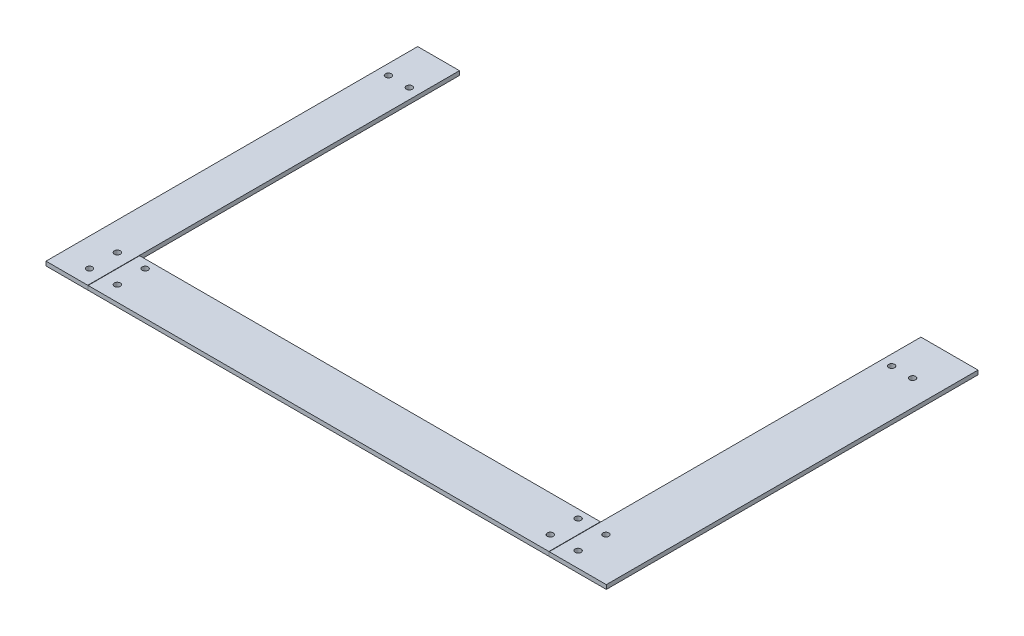
from build123d import *

# Parameters (mm, degrees)
SKETCH1_W                     = 41
SKETCH1_H                     = 267
BOSS_EXTRUDE1_DEPTH           = 3
SKETCH2_W                     = 30
SKETCH2_H                     = 267
BOSS_EXTRUDE2_DEPTH           = 3
SKETCH3_W                     = 331
SKETCH3_H                     = 37
BOSS_EXTRUDE3_DEPTH           = 3
SKETCH6_W                     = 2.15
SKETCH6_H                     = 3
M4_CLEARANCE_HOLE1_AT_2_COUNT = 2
M4_CLEARANCE_HOLE1_AT_2_PITCH = 28.284271247
M4_CLEARANCE_HOLE1_AT_3_COUNT = 2
M4_CLEARANCE_HOLE1_AT_3_PITCH = 20
M4_CLEARANCE_HOLE1_AT_4_COUNT = 2
M4_CLEARANCE_HOLE1_AT_4_PITCH = 20
M4_CLEARANCE_HOLE1_AT_5_COUNT = 2
M4_CLEARANCE_HOLE1_AT_5_PITCH = 210.068589989
M4_CLEARANCE_HOLE1_AT_6_COUNT = 2
M4_CLEARANCE_HOLE1_AT_6_PITCH = 208.257802975
MIRROR1_COPY_1_SKETCH_W       = 2.15
MIRROR1_COPY_1_SKETCH_H       = 3
MIRROR1_COPY_2_SKETCH_W       = 2.15
MIRROR1_COPY_2_SKETCH_H       = 3
MIRROR1_COPY_3_SKETCH_W       = 2.15
MIRROR1_COPY_3_SKETCH_H       = 3
MIRROR1_COPY_4_SKETCH_W       = 2.15
MIRROR1_COPY_4_SKETCH_H       = 3
MIRROR1_COPY_5_SKETCH_W       = 2.15
MIRROR1_COPY_5_SKETCH_H       = 3


with BuildPart() as part:
    # Sketch1 → Boss-Extrude1 (new body)
    with BuildSketch(Plane(origin=(0, 0, 0), x_dir=(1, 0, 0), z_dir=(0, 1, 0))):
        with Locations((186.25, -2)):
            Rectangle(SKETCH1_W, SKETCH1_H)
    extrude(amount=BOSS_EXTRUDE1_DEPTH)

    # Mirror1 copy 1 sketch → Mirror1 copy 1 (revolve, cut)
    with BuildSketch(Plane(origin=(175.5, 3, 124.5), x_dir=(0, 0, 1), z_dir=(-1, 0, 0))):
        with Locations((1.075, -1.5)):
            Rectangle(MIRROR1_COPY_1_SKETCH_W, MIRROR1_COPY_1_SKETCH_H)
    revolve(axis=Axis((175.5, 9.35, 124.5), (0, 1, 0)), mode=Mode.SUBTRACT)

    # Mirror1 copy 2 sketch → Mirror1 copy 2 (revolve, cut)
    with BuildSketch(Plane(origin=(175.5, 3, 104.5), x_dir=(0, 0, 1), z_dir=(-1, 0, 0))):
        with Locations((1.075, -1.5)):
            Rectangle(MIRROR1_COPY_2_SKETCH_W, MIRROR1_COPY_2_SKETCH_H)
    revolve(axis=Axis((175.5, 9.35, 104.5), (0, 1, 0)), mode=Mode.SUBTRACT)

    # Mirror1 copy 4 sketch → Mirror1 copy 4 (revolve, cut)
    with BuildSketch(Plane(origin=(188.25, 3, -103), x_dir=(0, 0, 1), z_dir=(-1, 0, 0))):
        with Locations((1.075, -1.5)):
            Rectangle(MIRROR1_COPY_4_SKETCH_W, MIRROR1_COPY_4_SKETCH_H)
    revolve(axis=Axis((188.25, 9.35, -103), (0, 1, 0)), mode=Mode.SUBTRACT)

    # Mirror1 copy 5 sketch → Mirror1 copy 5 (revolve, cut)
    with BuildSketch(Plane(origin=(173.25, 3, -103), x_dir=(0, 0, 1), z_dir=(-1, 0, 0))):
        with Locations((1.075, -1.5)):
            Rectangle(MIRROR1_COPY_5_SKETCH_W, MIRROR1_COPY_5_SKETCH_H)
    revolve(axis=Axis((173.25, 9.35, -103), (0, 1, 0)), mode=Mode.SUBTRACT)


with BuildPart() as body_2:
    # Sketch2 → Boss-Extrude2 (new body)
    with BuildSketch(Plane(origin=(0, 0, 0), x_dir=(1, 0, 0), z_dir=(0, 1, 0))):
        with Locations((-180.75, -2)):
            Rectangle(SKETCH2_W, SKETCH2_H)
    extrude(amount=BOSS_EXTRUDE2_DEPTH)


with BuildPart() as body_3:
    # Sketch3 → Boss-Extrude3 (new body)
    with BuildSketch(Plane(origin=(0, 0, 0), x_dir=(1, 0, 0), z_dir=(0, 1, 0))):
        with Locations((0, -117)):
            Rectangle(SKETCH3_W, SKETCH3_H)
    extrude(amount=BOSS_EXTRUDE3_DEPTH)

    # Sketch6 → M4 Clearance Hole1 (revolve, cut)
    with BuildSketch(Plane(origin=(-155.5, 3, 104.5), x_dir=(0, 0, 1), z_dir=(1, 0, 0))):
        with Locations((1.075, 1.5)):
            Rectangle(SKETCH6_W, SKETCH6_H)
    m4_clearance_hole1 = revolve(axis=Axis((-155.5, 9.35, 104.5), (0, -1, 0)), mode=Mode.SUBTRACT)

    # M4 Clearance Hole1 at 4: M4 Clearance Hole1 ×2
    with Locations(*[(0, 0, i * M4_CLEARANCE_HOLE1_AT_4_PITCH) for i in range(1, M4_CLEARANCE_HOLE1_AT_4_COUNT)]):
        add(m4_clearance_hole1, mode=Mode.SUBTRACT)

    # Mirror1: M4 Clearance Hole1 across plane
    add(m4_clearance_hole1.mirror(Plane(origin=(0, 0, 0), x_dir=(0, 0, 1), z_dir=(1, 0, 0))), mode=Mode.SUBTRACT)

    # Mirror1 copy 3 sketch → Mirror1 copy 3 (revolve, cut)
    with BuildSketch(Plane(origin=(155.5, 3, 124.5), x_dir=(0, 0, 1), z_dir=(-1, 0, 0))):
        with Locations((1.075, -1.5)):
            Rectangle(MIRROR1_COPY_3_SKETCH_W, MIRROR1_COPY_3_SKETCH_H)
    revolve(axis=Axis((155.5, 9.35, 124.5), (0, 1, 0)), mode=Mode.SUBTRACT)


with BuildPart() as body_2_1:
    add(body_2.part)

    # M4 Clearance Hole1 at 2: M4 Clearance Hole1 ×2
    with Locations(*[Vector(-0.7071067811865478, 0, 0.7071067811865472) * (i * M4_CLEARANCE_HOLE1_AT_2_PITCH) for i in range(1, M4_CLEARANCE_HOLE1_AT_2_COUNT)]):
        add(m4_clearance_hole1, mode=Mode.SUBTRACT)

    # M4 Clearance Hole1 at 3: M4 Clearance Hole1 ×2
    with Locations(*[(-i * M4_CLEARANCE_HOLE1_AT_3_PITCH, 0, 0) for i in range(1, M4_CLEARANCE_HOLE1_AT_3_COUNT)]):
        add(m4_clearance_hole1, mode=Mode.SUBTRACT)

    # M4 Clearance Hole1 at 5: M4 Clearance Hole1 ×2
    with Locations(*[Vector(-0.15590146057391321, 0, -0.9877726127965487) * (i * M4_CLEARANCE_HOLE1_AT_5_PITCH) for i in range(1, M4_CLEARANCE_HOLE1_AT_5_COUNT)]):
        add(m4_clearance_hole1, mode=Mode.SUBTRACT)

    # M4 Clearance Hole1 at 6: M4 Clearance Hole1 ×2
    with Locations(*[Vector(-0.08523090009801677, 0, -0.9963612264979413) * (i * M4_CLEARANCE_HOLE1_AT_6_PITCH) for i in range(1, M4_CLEARANCE_HOLE1_AT_6_COUNT)]):
        add(m4_clearance_hole1, mode=Mode.SUBTRACT)


solid = Compound([part.part, body_3.part, body_2_1.part])
